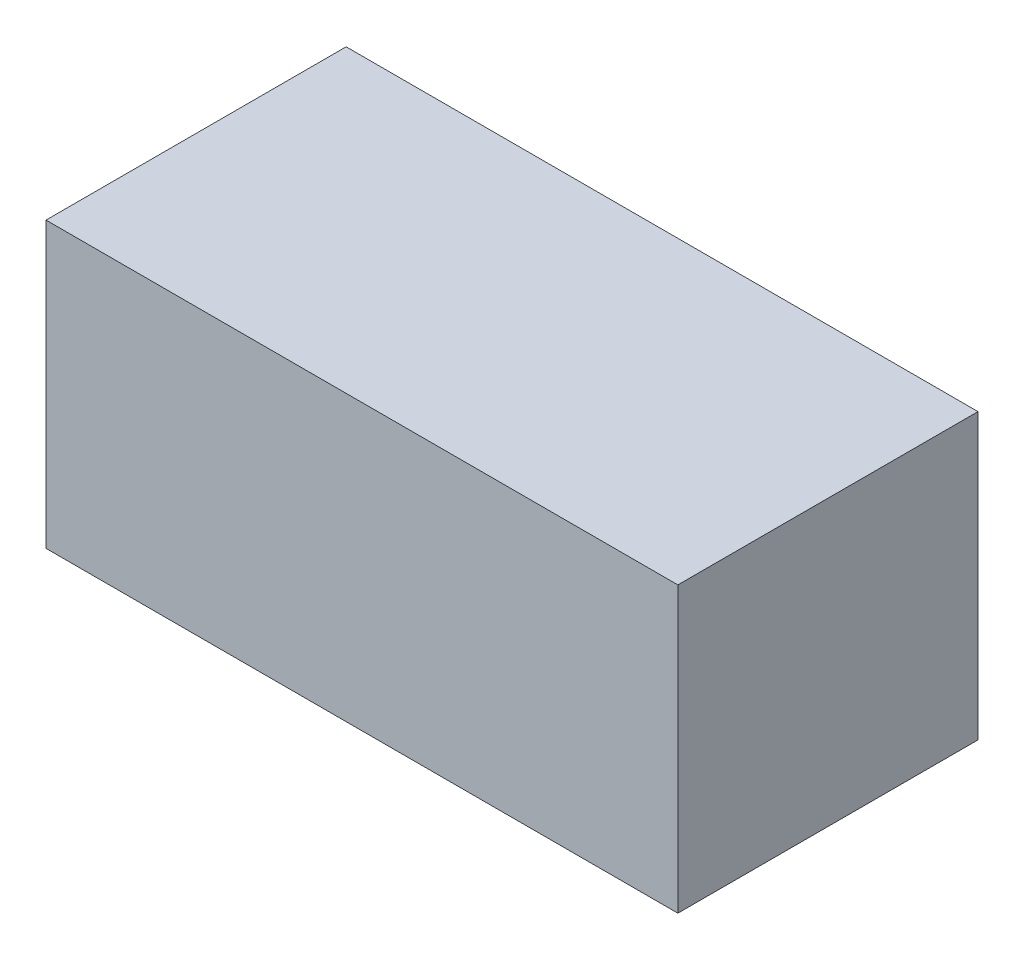
from build123d import *

# Parameters (mm, degrees)
SKETCH_1_W          = 200
SKETCH_1_H          = 95
EXTRUDE_1_DEPTH     = 90
SKETCH_2_R          = 30
CUT_EXTRUDE_1_DEPTH = 10


with BuildPart() as part:
    # 草图1 → 凸台-拉伸1 (new body)
    with BuildSketch(Plane(origin=(0, 0, 0), x_dir=(1, 0, 0), z_dir=(0, 1, 0))):
        with Locations((100, 47.5)):
            Rectangle(SKETCH_1_W, SKETCH_1_H)
    extrude(amount=EXTRUDE_1_DEPTH)

    # 草图2 → 切除-拉伸1 (cut)
    with BuildSketch(Plane(origin=(0, 0, 0), x_dir=(-1, 0, 0), z_dir=(0, -1, 0))):
        with Locations(Location((-50, 47.5, 0), (0, 0, 90))):
            Circle(SKETCH_2_R)
    extrude(amount=-CUT_EXTRUDE_1_DEPTH, mode=Mode.SUBTRACT)


solid = part.part
